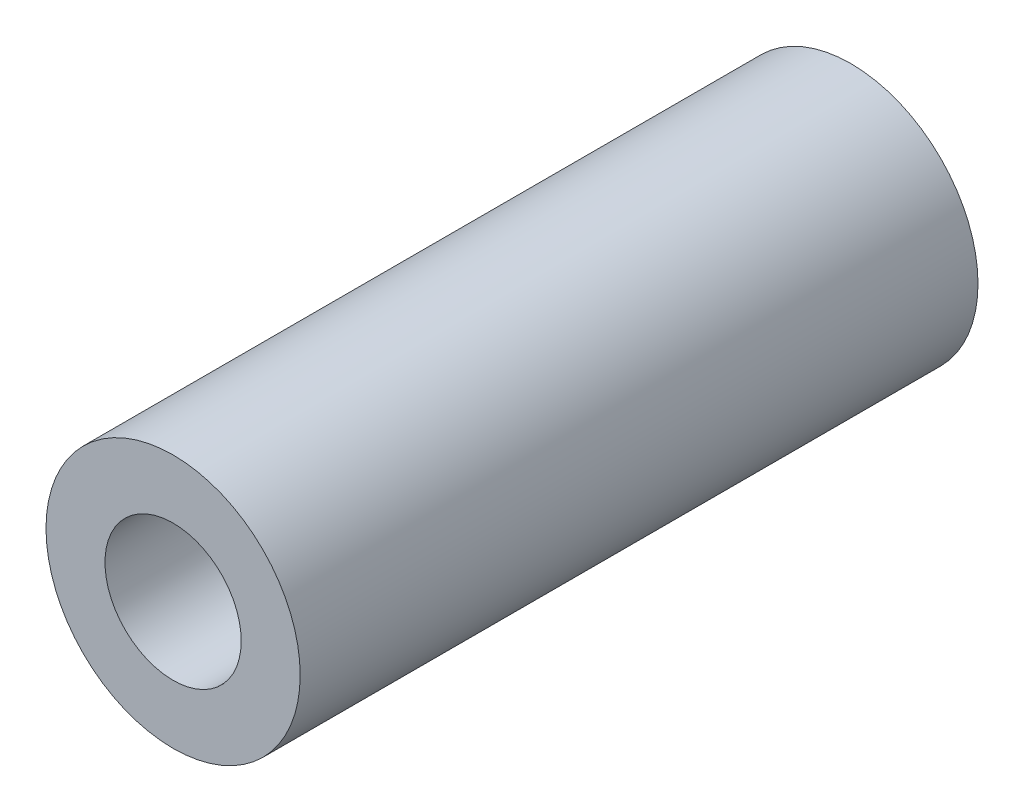
from build123d import *

# Parameters (mm, degrees)
SKETCH1_R              = 4.7625
BOSS_EXTRUDE1_DEPTH    = 25.4
F_10_CLEARANCE_HOLE1_D = 5.1054


with BuildPart() as part:
    # Sketch1 → Boss-Extrude1 (new body)
    with BuildSketch(Plane.XY):
        Circle(SKETCH1_R)
    extrude(amount=BOSS_EXTRUDE1_DEPTH)

    # #10 Clearance Hole1 (through all)
    with Locations(Plane.XY.offset(25.4)):
        with Locations((0, 0)):
            Hole(F_10_CLEARANCE_HOLE1_D / 2)


solid = part.part
